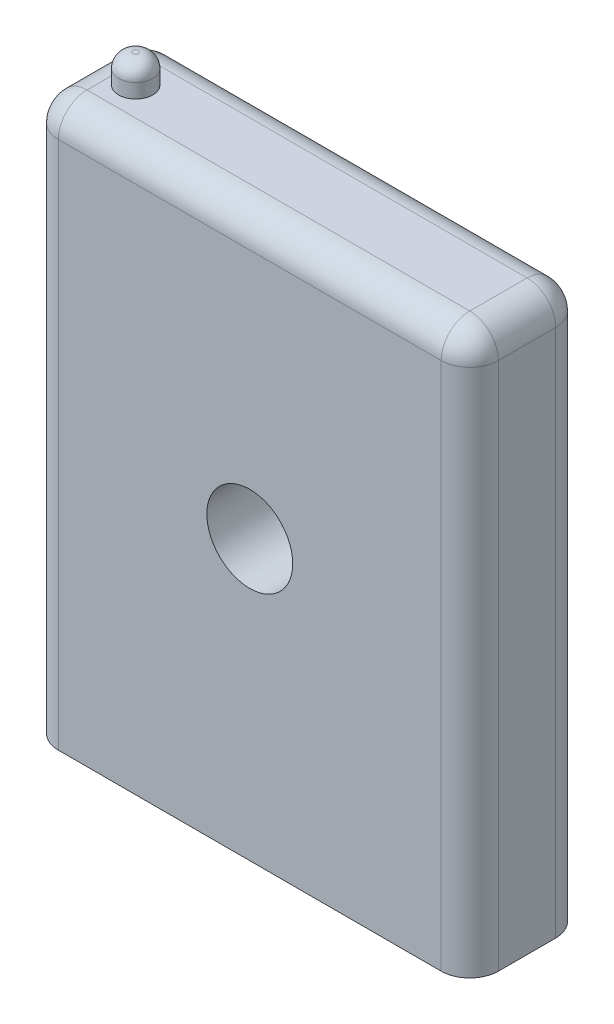
from build123d import *

# Parameters (mm, degrees)
SKETCH1_W           = 76.879071809
SKETCH1_H           = 97.396637597
BOSS_EXTRUDE1_DEPTH = 20
SKETCH2_R           = 7.5
CUT_EXTRUDE1_DEPTH  = 20
FILLET2_R           = 5
FILLET3_R           = 5
FILLET4_R           = 5
FILLET5_R           = 5
SKETCH3_R           = 2.996522069
BOSS_EXTRUDE2_DEPTH = 5
FILLET7_R           = 2.5


with BuildPart() as part:
    # Sketch1 → Boss-Extrude1 (new body)
    with BuildSketch(Plane.XY):
        with Locations((36.214739615, -28.675152186)):
            Rectangle(SKETCH1_W, SKETCH1_H)
    extrude(amount=BOSS_EXTRUDE1_DEPTH)

    # Sketch2 → Cut-Extrude1 (cut)
    with BuildSketch(Plane.XY.offset(20)):
        with Locations((36.214739614, -28.675152186)):
            Circle(SKETCH2_R)
    extrude(amount=-CUT_EXTRUDE1_DEPTH, mode=Mode.SUBTRACT)

    # Fillet2
    fillet2_edges = [part.edges().sort_by_distance(p)[0] for p in [
        (74.654275519, 20.023166613, 10),
    ]]
    fillet(fillet2_edges, radius=FILLET2_R)

    # Fillet3
    fillet3_edges = [part.edges().sort_by_distance(p)[0] for p in [
        (74.654275519, -31.175152186, 20),
        (33.714739614, 20.023166613, 20),
        (73.189809425, 18.558700519, 20),
    ]]
    fillet(fillet3_edges, radius=FILLET3_R)

    # Fillet4
    fillet4_edges = [part.edges().sort_by_distance(p)[0] for p in [
        (33.714739614, 20.023166613, 0),
        (73.189809425, 18.558700519, 0),
        (74.654275519, -31.175152186, 0),
    ]]
    fillet(fillet4_edges, radius=FILLET4_R)

    # Fillet5
    fillet5_edges = [part.edges().sort_by_distance(p)[0] for p in [
        (-2.22479629, -31.175152186, 20),
        (-2.22479629, 20.023166613, 10),
        (-2.22479629, 18.558700519, 18.535533906),
        (-2.22479629, -31.175152186, 0),
        (-2.22479629, 18.558700519, 1.464466094),
    ]]
    fillet(fillet5_edges, radius=FILLET5_R)

    # Sketch3 → Boss-Extrude2 (add)
    with BuildSketch(Plane(origin=(0, 20.023166613, 0), x_dir=(1, 0, 0), z_dir=(0, 1, 0))):
        with Locations(Location((6.286432744, -10, 0), (0, 0, 90))):
            Circle(SKETCH3_R)
    extrude(amount=BOSS_EXTRUDE2_DEPTH)

    # Fillet7
    fillet7_edges = [part.edges().sort_by_distance(p)[0] for p in [
        (6.286432744, 25.023166613, 12.996522069),
    ]]
    fillet(fillet7_edges, radius=FILLET7_R)


solid = part.part
